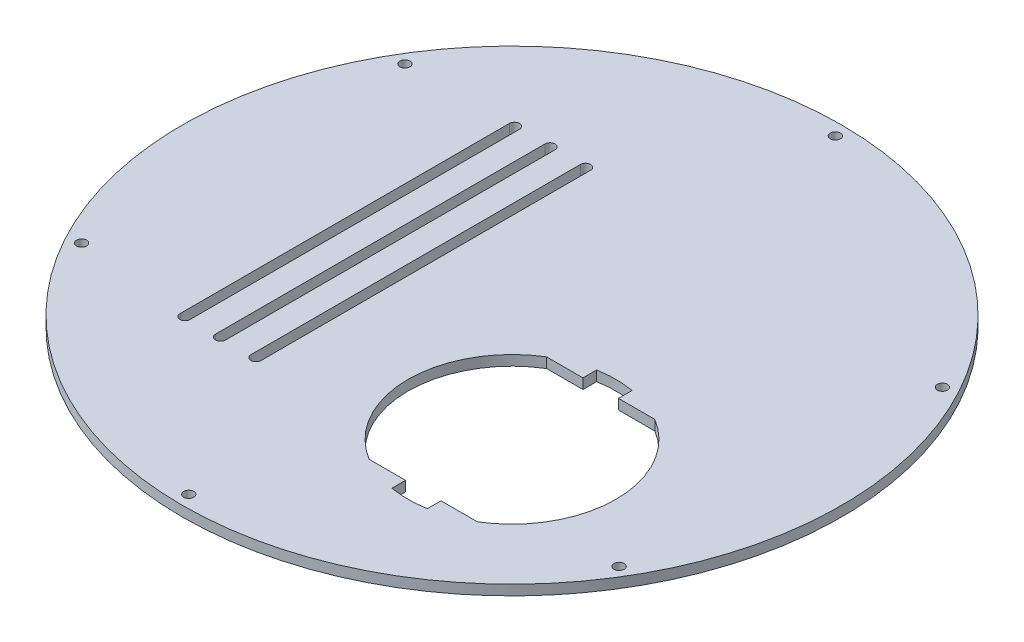
from build123d import *

# Parameters (mm, degrees)
ESQUISSE1_R              = 65
BOSS_EXTRU_1_DEPTH       = 2
ESQUISSE2_R              = 1
ENL_V_MAT_EXTRU_1_DEPTH  = 3
ESQUISSE3_R              = 7.5
ENL_V_MAT_EXTRU_2_DEPTH  = 3
ESQUISSE4_R              = 2
ENL_V_MAT_EXTRU_4_DEPTH  = 4
ESQUISSE5_R              = 7.5
BOSS_EXTRU_3_DEPTH       = 4
ESQUISSE6_R              = 2
BOSS_EXTRU_5_DEPTH       = 2
ENL_V_START              = -2
ESQUISSE11_R             = 7.5
ENL_V_MAT_EXTRU_7_DEPTH  = 2
ENL_V_MAT_EXTRU_10_DEPTH = 92.945636112
ENL_V_MAT_EXTRU_11_DEPTH = 10


with BuildPart() as part:
    # Esquisse1 → Boss.-Extru.1 (new body)
    with BuildSketch(Plane(origin=(0, 0, 0), x_dir=(1, 0, 0), z_dir=(0, 1, 0))):
        with Locations(Location((0, 0, 0), (0, 0, 270))):
            Circle(ESQUISSE1_R)
    extrude(amount=BOSS_EXTRU_1_DEPTH)

    # Esquisse2 → Enlèv. mat.-Extru.1 (cut)
    with BuildSketch(Plane(origin=(0, 2, 0), x_dir=(1, 0, 0), z_dir=(0, 1, 0))):
        with Locations(Location((-53.47585562, 32.350932996, 0), (0, 0, 270))):
            Circle(ESQUISSE2_R)
        with Locations(Location((-54.754657621, -30.135982958, 0), (0, 0, 270))):
            Circle(ESQUISSE2_R)
        with Locations(Location((-1.278802001, -62.486915954, 0), (0, 0, 270))):
            Circle(ESQUISSE2_R)
        with Locations(Location((53.47585562, -32.350932996, 0), (0, 0, 270))):
            Circle(ESQUISSE2_R)
        with Locations(Location((54.754657621, 30.135982958, 0), (0, 0, 270))):
            Circle(ESQUISSE2_R)
        with Locations(Location((1.278802001, 62.486915954, 0), (0, 0, 270))):
            Circle(ESQUISSE2_R)
    extrude(amount=-ENL_V_MAT_EXTRU_1_DEPTH, mode=Mode.SUBTRACT)

    # Esquisse3 → Enlèv. mat.-Extru.2 (cut)
    with BuildSketch(Plane(origin=(0, 2, 0), x_dir=(1, 0, 0), z_dir=(0, 1, 0))):
        with Locations(Location((0, 0, 0), (0, 0, 270))):
            Circle(ESQUISSE3_R)
    extrude(amount=-ENL_V_MAT_EXTRU_2_DEPTH, mode=Mode.SUBTRACT)

    # Esquisse4 → Enlèv. mat.-Extru.4 (cut)
    with BuildSketch(Plane(origin=(0, 2, 0), x_dir=(1, 0, 0), z_dir=(0, 1, 0))):
        with Locations(Location((0, 33.5, 0), (0, 0, 270))):
            Circle(ESQUISSE4_R)
        with Locations(Location((29.011851027, 16.75, 0), (0, 0, 270))):
            Circle(ESQUISSE4_R)
        with Locations(Location((29.011851027, -16.75, 0), (0, 0, 270))):
            Circle(ESQUISSE4_R)
        with Locations(Location((0, -33.5, 0), (0, 0, 270))):
            Circle(ESQUISSE4_R)
        with Locations(Location((-29.011851027, -16.75, 0), (0, 0, 270))):
            Circle(ESQUISSE4_R)
        with Locations(Location((-29.011851027, 16.75, 0), (0, 0, 270))):
            Circle(ESQUISSE4_R)
    extrude(amount=-ENL_V_MAT_EXTRU_4_DEPTH, mode=Mode.SUBTRACT)

    # Esquisse5 → Boss.-Extru.3 (add)
    with BuildSketch(Plane(origin=(0, 2, 0), x_dir=(1, 0, 0), z_dir=(0, 1, 0))):
        with Locations(Location((0, 0, 0), (0, 0, 270))):
            Circle(ESQUISSE5_R)
    extrude(amount=-BOSS_EXTRU_3_DEPTH)

    # Esquisse6 → Boss.-Extru.5 (add)
    with BuildSketch(Plane(origin=(0, 2, 0), x_dir=(1, 0, 0), z_dir=(0, 1, 0))):
        with Locations((-29.011851027, 16.75)):
            Circle(ESQUISSE6_R)
        with Locations((29.011851027, 16.75)):
            Circle(ESQUISSE6_R)
        with Locations((29.011851027, -16.75)):
            Circle(ESQUISSE6_R)
        with Locations((0, -33.5)):
            Circle(ESQUISSE6_R)
        with Locations((-29.011851027, -16.75)):
            Circle(ESQUISSE6_R)
        with Locations((0, 33.5)):
            Circle(ESQUISSE6_R)
    extrude(amount=-BOSS_EXTRU_5_DEPTH)

    # Esquisse11 → Enlèv. mat.-Extru.7 (cut)
    with BuildSketch(Plane(origin=(0, -2, 0), x_dir=(-1, 0, 0), z_dir=(0, -1, 0)).offset(ENL_V_START)):
        Circle(ESQUISSE11_R)
    extrude(amount=ENL_V_MAT_EXTRU_7_DEPTH, mode=Mode.SUBTRACT)

    # Esquisse13 → Enlèv. mat.-Extru.10 (cut, through all)
    with BuildSketch(Plane(origin=(0, 0, 0), x_dir=(-1, 0, 0), z_dir=(0, -1, 0))):
        with BuildLine():
            Line((-17.713203436, -3.713203436), (-21.213203436, -3.713203436))
            Line((-21.213203436, -3.713203436), (-21.213203436, -38.713203436))
            Line((-21.213203436, -38.713203436), (-17.713203436, -38.713203436))
            Line((-17.713203436, -38.713203436), (-10.536125184, -38.713203436))
            ThreePointArc((-10.536125184, -38.713203436), (-3.336820913, -31.247392387), (-0.713203436, -21.213203436))
            ThreePointArc((-0.713203436, -21.213203436), (-3.336820913, -11.179014484), (-10.536125184, -3.713203436))
            Line((-10.536125184, -3.713203436), (-17.713203436, -3.713203436))
        make_face()
        with BuildLine():
            Line((-21.213203436, -38.713203436), (-21.213203436, -3.713203436))
            Line((-21.213203436, -3.713203436), (-24.713203436, -3.713203436))
            Line((-24.713203436, -3.713203436), (-31.890281688, -3.713203436))
            ThreePointArc((-31.890281688, -3.713203436), (-41.713203436, -21.213203436), (-31.890281688, -38.713203436))
            Line((-31.890281688, -38.713203436), (-24.713203436, -38.713203436))
            Line((-24.713203436, -38.713203436), (-21.213203436, -38.713203436))
        make_face()
        with BuildLine():
            Line((-21.213203436, -3.713203436), (-21.213203436, -0.713203436))
            ThreePointArc((-21.213203436, -0.713203436), (-22.969662591, -0.788589578), (-24.713203436, -1.014193559))
            Line((-24.713203436, -1.014193559), (-24.713203436, -3.713203436))
            Line((-24.713203436, -3.713203436), (-21.213203436, -3.713203436))
        make_face()
        with BuildLine():
            ThreePointArc((-17.713203436, -1.014193559), (-19.45674428, -0.788589578), (-21.213203436, -0.713203436))
            Line((-21.213203436, -0.713203436), (-21.213203436, -3.713203436))
            Line((-21.213203436, -3.713203436), (-17.713203436, -3.713203436))
            Line((-17.713203436, -3.713203436), (-17.713203436, -1.014193559))
        make_face()
        with BuildLine():
            Line((-17.713203436, -38.713203436), (-21.213203436, -38.713203436))
            Line((-21.213203436, -38.713203436), (-21.213203436, -41.713203436))
            ThreePointArc((-21.213203436, -41.713203436), (-19.45674428, -41.637817293), (-17.713203436, -41.412213312))
            Line((-17.713203436, -41.412213312), (-17.713203436, -38.713203436))
        make_face()
        with BuildLine():
            Line((-21.213203436, -41.713203436), (-21.213203436, -38.713203436))
            Line((-21.213203436, -38.713203436), (-24.713203436, -38.713203436))
            Line((-24.713203436, -38.713203436), (-24.713203436, -41.412213312))
            ThreePointArc((-24.713203436, -41.412213312), (-22.969662591, -41.637817293), (-21.213203436, -41.713203436))
        make_face()
    extrude(amount=-ENL_V_MAT_EXTRU_10_DEPTH, mode=Mode.SUBTRACT)

    # Esquisse14 → Enlèv. mat.-Extru.11 (cut)
    with BuildSketch(Plane(origin=(0, 0, 0), x_dir=(-1, 0, 0), z_dir=(0, -1, 0))):
        with BuildLine():
            Line((24, -32.5), (24, 32.5))
            ThreePointArc((24, 32.5), (25, 33.5), (26, 32.5))
            Line((26, 32.5), (26, -32.5))
            ThreePointArc((26, -32.5), (25, -33.5), (24, -32.5))
        make_face()
        with BuildLine():
            Line((31.003124215, -32.5), (31.003124215, 32.5))
            ThreePointArc((31.003124215, 32.5), (32.003124215, 33.5), (33.003124215, 32.5))
            Line((33.003124215, 32.5), (33.003124215, -32.5))
            ThreePointArc((33.003124215, -32.5), (32.003124215, -33.5), (31.003124215, -32.5))
        make_face()
        with BuildLine():
            Line((16.996875785, -32.5), (16.996875785, 32.5))
            ThreePointArc((16.996875785, 32.5), (17.996875785, 33.5), (18.996875785, 32.5))
            Line((18.996875785, 32.5), (18.996875785, -32.5))
            ThreePointArc((18.996875785, -32.5), (17.996875785, -33.5), (16.996875785, -32.5))
        make_face()
    extrude(amount=-ENL_V_MAT_EXTRU_11_DEPTH, mode=Mode.SUBTRACT)


solid = part.part
